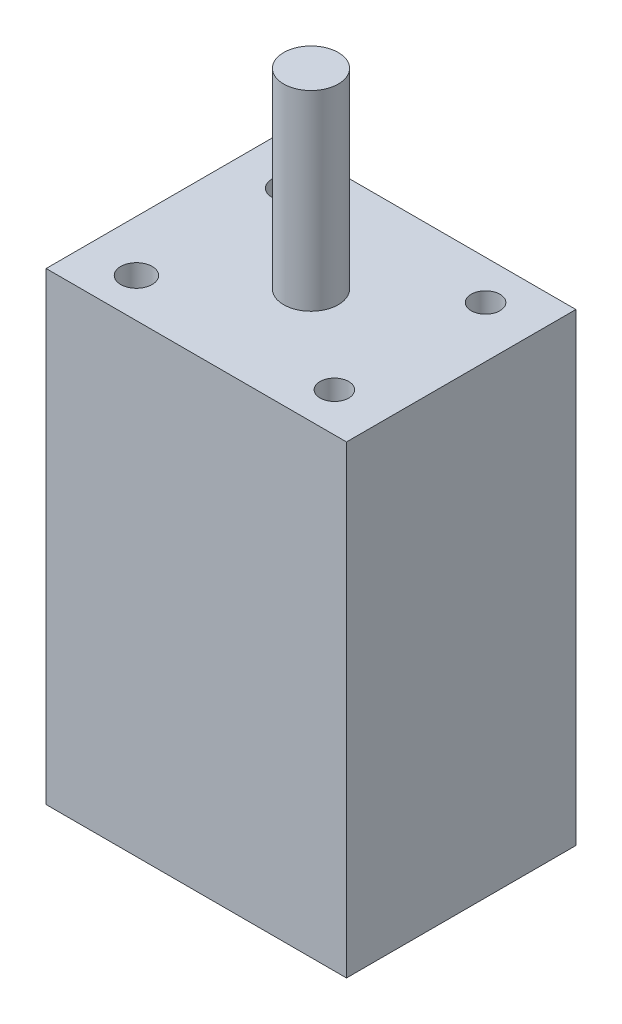
from build123d import *

# Parameters (mm, degrees)
F_01_HOUSING_PROFILE_W      = 55
F_01_HOUSING_PROFILE_H      = 42
F_01_HOUSING_PROFILE_R      = 2.877277304
F_01_HOUSING_PROFILE_R_2    = 2.627218626
F_01_HOUSING_BLOCK_DEPTH    = 85
F_03_OUTPUT_SHAFT_PROFILE_R = 5
F_03_OUTPUT_SHAFT_DEPTH     = 120


with BuildPart() as part:
    # 01_Housing_Profile → 01_Housing_Block (new body)
    with BuildSketch(Plane(origin=(0, 0, 0), x_dir=(1, 0, 0), z_dir=(0, 1, 0))):
        Rectangle(F_01_HOUSING_PROFILE_W, F_01_HOUSING_PROFILE_H)
        with Locations(Location((-18.122781374, -13.839214867, 0), (0, 0, 270))):
            Circle(F_01_HOUSING_PROFILE_R, mode=Mode.SUBTRACT)
        with Locations(Location((18.122781374, -13.839214867, 0), (0, 0, 270))):
            Circle(F_01_HOUSING_PROFILE_R_2, mode=Mode.SUBTRACT)
        with Locations(Location((-18.122781374, 13.839214867, 0), (0, 0, 270))):
            Circle(F_01_HOUSING_PROFILE_R, mode=Mode.SUBTRACT)
        with Locations(Location((18.122781374, 13.839214867, 0), (0, 0, 270))):
            Circle(F_01_HOUSING_PROFILE_R_2, mode=Mode.SUBTRACT)
    extrude(amount=F_01_HOUSING_BLOCK_DEPTH)

    # 03_Output_Shaft_Profile → 03_Output_Shaft (add)
    with BuildSketch(Plane(origin=(0, 0, 0), x_dir=(1, 0, 0), z_dir=(0, 1, 0))):
        with Locations(Location((0, 0, 0), (0, 0, 90))):
            Circle(F_03_OUTPUT_SHAFT_PROFILE_R)
    extrude(amount=F_03_OUTPUT_SHAFT_DEPTH)


solid = part.part
